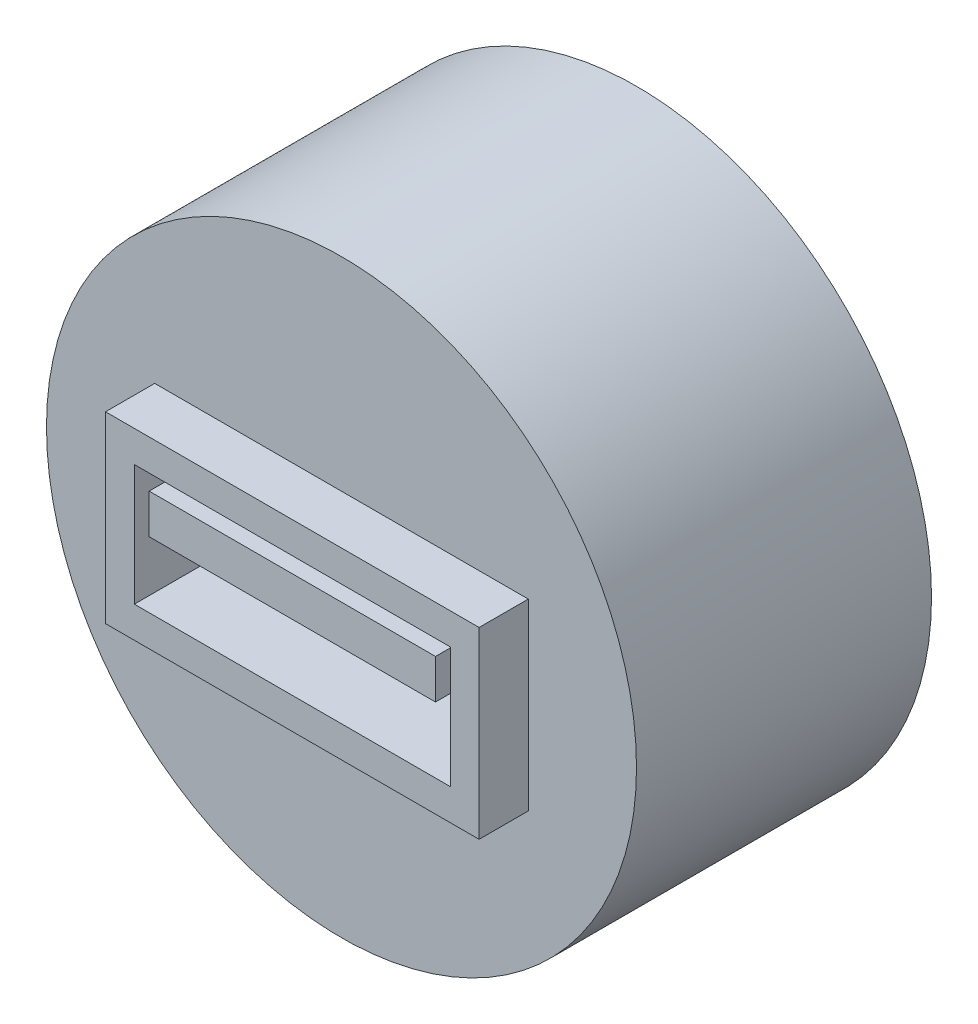
from build123d import *

# Parameters (mm, degrees)
SKETCH2_R           = 12
BOSS_EXTRUDE1_DEPTH = 12
SKETCH4_W           = 15.195212274
SKETCH4_H           = 7.463727614
SKETCH4_W_2         = 12.852338134
SKETCH4_H_2         = 4.920035692
BOSS_EXTRUDE2_DEPTH = 2
SKETCH5_W           = 11.647431434
SKETCH5_H           = 1.606542266
BOSS_EXTRUDE3_DEPTH = 2
SKETCH6_W           = 12.852338134
SKETCH6_H           = 4.920035692
SKETCH6_W_2         = 11.647431434
SKETCH6_H_2         = 1.606542266
CUT_EXTRUDE1_DEPTH  = 2


with BuildPart() as part:
    # Sketch2 → Boss-Extrude1 (new body)
    with BuildSketch(Plane.XY):
        Circle(SKETCH2_R)
    extrude(amount=BOSS_EXTRUDE1_DEPTH)

    # Sketch4 → Boss-Extrude2 (add)
    with BuildSketch(Plane.XY.offset(12)):
        Rectangle(SKETCH4_W, SKETCH4_H)
        Rectangle(SKETCH4_W_2, SKETCH4_H_2, mode=Mode.SUBTRACT)
    extrude(amount=BOSS_EXTRUDE2_DEPTH)

    # Sketch5 → Boss-Extrude3 (add)
    with BuildSketch(Plane.XY.offset(12)):
        with Locations((0, 1.020823732)):
            Rectangle(SKETCH5_W, SKETCH5_H)
    extrude(amount=BOSS_EXTRUDE3_DEPTH)

    # Sketch6 → Cut-Extrude1 (cut)
    with BuildSketch(Plane.XY.offset(12)):
        Rectangle(SKETCH6_W, SKETCH6_H)
        with Locations((0, 1.020823732)):
            Rectangle(SKETCH6_W_2, SKETCH6_H_2, mode=Mode.SUBTRACT)
    extrude(amount=-CUT_EXTRUDE1_DEPTH, mode=Mode.SUBTRACT)


solid = part.part
